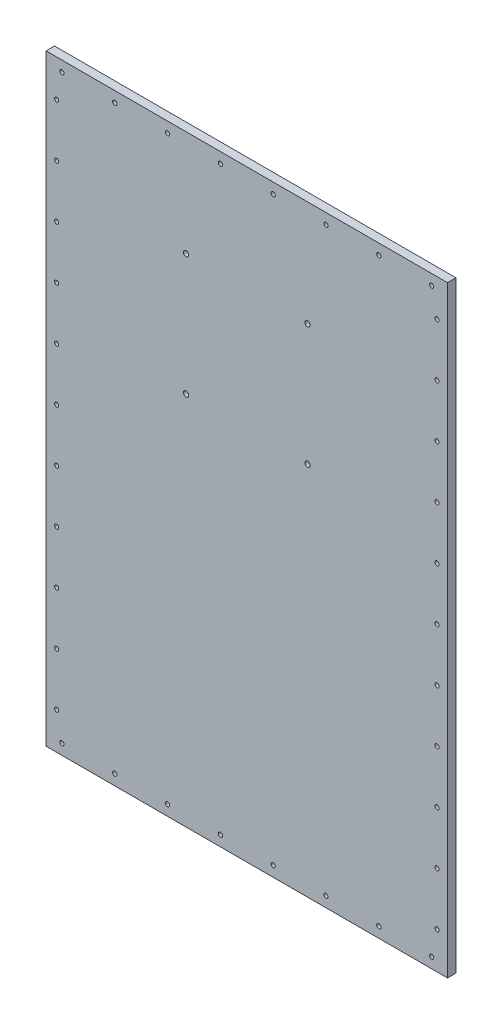
from build123d import *

# Parameters (mm, degrees)
SKETCH_1_W          = 380
SKETCH_1_H          = 570
EXTRUDE_1_DEPTH     = 8
CUT_EXTRUDE_1_REACH = 344.621
SKETCH_2_R          = 2
CUT_EXTRUDE_2_REACH = 344.621
SKETCH_3_R          = 2.5
CUT_EXTRUDE_3_REACH = 344.621
SKETCH_4_R          = 2


with BuildPart() as part:
    # 草图1 → 凸台-拉伸1 (new body)
    with BuildSketch(Plane.XY):
        Rectangle(SKETCH_1_W, SKETCH_1_H)
    extrude(amount=EXTRUDE_1_DEPTH)

    # 草图2 → 切除-拉伸1 (cut, up to next)
    with BuildSketch(Plane.XY.offset(8), mode=Mode.PRIVATE) as cut_extrude_1_sk1:
        with Locations((-180, 250)):
            Circle(SKETCH_2_R)
    cut_extrude_1_tool1 = extrude(cut_extrude_1_sk1.sketch, amount=-CUT_EXTRUDE_1_REACH, mode=Mode.PRIVATE) & part.part
    # 草图2 → 切除-拉伸1 (cut, up to next)
    with BuildSketch(Plane.XY.offset(8), mode=Mode.PRIVATE) as cut_extrude_1_sk2:
        with Locations((-180, 200)):
            Circle(SKETCH_2_R)
    cut_extrude_1_tool2 = extrude(cut_extrude_1_sk2.sketch, amount=-CUT_EXTRUDE_1_REACH, mode=Mode.PRIVATE) & part.part
    # 草图2 → 切除-拉伸1 (cut, up to next)
    with BuildSketch(Plane.XY.offset(8), mode=Mode.PRIVATE) as cut_extrude_1_sk3:
        with Locations((-180, 150)):
            Circle(SKETCH_2_R)
    cut_extrude_1_tool3 = extrude(cut_extrude_1_sk3.sketch, amount=-CUT_EXTRUDE_1_REACH, mode=Mode.PRIVATE) & part.part
    # 草图2 → 切除-拉伸1 (cut, up to next)
    with BuildSketch(Plane.XY.offset(8), mode=Mode.PRIVATE) as cut_extrude_1_sk4:
        with Locations((-180, 100)):
            Circle(SKETCH_2_R)
    cut_extrude_1_tool4 = extrude(cut_extrude_1_sk4.sketch, amount=-CUT_EXTRUDE_1_REACH, mode=Mode.PRIVATE) & part.part
    # 草图2 → 切除-拉伸1 (cut, up to next)
    with BuildSketch(Plane.XY.offset(8), mode=Mode.PRIVATE) as cut_extrude_1_sk5:
        with Locations((-180, 50)):
            Circle(SKETCH_2_R)
    cut_extrude_1_tool5 = extrude(cut_extrude_1_sk5.sketch, amount=-CUT_EXTRUDE_1_REACH, mode=Mode.PRIVATE) & part.part
    # 草图2 → 切除-拉伸1 (cut, up to next)
    with BuildSketch(Plane.XY.offset(8), mode=Mode.PRIVATE) as cut_extrude_1_sk6:
        with Locations((-180, 0)):
            Circle(SKETCH_2_R)
    cut_extrude_1_tool6 = extrude(cut_extrude_1_sk6.sketch, amount=-CUT_EXTRUDE_1_REACH, mode=Mode.PRIVATE) & part.part
    # 草图2 → 切除-拉伸1 (cut, up to next)
    with BuildSketch(Plane.XY.offset(8), mode=Mode.PRIVATE) as cut_extrude_1_sk7:
        with Locations((-180, -50)):
            Circle(SKETCH_2_R)
    cut_extrude_1_tool7 = extrude(cut_extrude_1_sk7.sketch, amount=-CUT_EXTRUDE_1_REACH, mode=Mode.PRIVATE) & part.part
    # 草图2 → 切除-拉伸1 (cut, up to next)
    with BuildSketch(Plane.XY.offset(8), mode=Mode.PRIVATE) as cut_extrude_1_sk8:
        with Locations((-180, -100)):
            Circle(SKETCH_2_R)
    cut_extrude_1_tool8 = extrude(cut_extrude_1_sk8.sketch, amount=-CUT_EXTRUDE_1_REACH, mode=Mode.PRIVATE) & part.part
    # 草图2 → 切除-拉伸1 (cut, up to next)
    with BuildSketch(Plane.XY.offset(8), mode=Mode.PRIVATE) as cut_extrude_1_sk9:
        with Locations((-180, -150)):
            Circle(SKETCH_2_R)
    cut_extrude_1_tool9 = extrude(cut_extrude_1_sk9.sketch, amount=-CUT_EXTRUDE_1_REACH, mode=Mode.PRIVATE) & part.part
    # 草图2 → 切除-拉伸1 (cut, up to next)
    with BuildSketch(Plane.XY.offset(8), mode=Mode.PRIVATE) as cut_extrude_1_sk10:
        with Locations((-180, -200)):
            Circle(SKETCH_2_R)
    cut_extrude_1_tool10 = extrude(cut_extrude_1_sk10.sketch, amount=-CUT_EXTRUDE_1_REACH, mode=Mode.PRIVATE) & part.part
    # 草图2 → 切除-拉伸1 (cut, up to next)
    with BuildSketch(Plane.XY.offset(8), mode=Mode.PRIVATE) as cut_extrude_1_sk11:
        with Locations((-180, -250)):
            Circle(SKETCH_2_R)
    cut_extrude_1_tool11 = extrude(cut_extrude_1_sk11.sketch, amount=-CUT_EXTRUDE_1_REACH, mode=Mode.PRIVATE) & part.part
    # 草图2 → 切除-拉伸1 (cut, up to next)
    with BuildSketch(Plane.XY.offset(8), mode=Mode.PRIVATE) as cut_extrude_1_sk12:
        with Locations((180, -250)):
            Circle(SKETCH_2_R)
    cut_extrude_1_tool12 = extrude(cut_extrude_1_sk12.sketch, amount=-CUT_EXTRUDE_1_REACH, mode=Mode.PRIVATE) & part.part
    # 草图2 → 切除-拉伸1 (cut, up to next)
    with BuildSketch(Plane.XY.offset(8), mode=Mode.PRIVATE) as cut_extrude_1_sk13:
        with Locations((180, -200)):
            Circle(SKETCH_2_R)
    cut_extrude_1_tool13 = extrude(cut_extrude_1_sk13.sketch, amount=-CUT_EXTRUDE_1_REACH, mode=Mode.PRIVATE) & part.part
    # 草图2 → 切除-拉伸1 (cut, up to next)
    with BuildSketch(Plane.XY.offset(8), mode=Mode.PRIVATE) as cut_extrude_1_sk14:
        with Locations((180, -150)):
            Circle(SKETCH_2_R)
    cut_extrude_1_tool14 = extrude(cut_extrude_1_sk14.sketch, amount=-CUT_EXTRUDE_1_REACH, mode=Mode.PRIVATE) & part.part
    # 草图2 → 切除-拉伸1 (cut, up to next)
    with BuildSketch(Plane.XY.offset(8), mode=Mode.PRIVATE) as cut_extrude_1_sk15:
        with Locations((180, -100)):
            Circle(SKETCH_2_R)
    cut_extrude_1_tool15 = extrude(cut_extrude_1_sk15.sketch, amount=-CUT_EXTRUDE_1_REACH, mode=Mode.PRIVATE) & part.part
    # 草图2 → 切除-拉伸1 (cut, up to next)
    with BuildSketch(Plane.XY.offset(8), mode=Mode.PRIVATE) as cut_extrude_1_sk16:
        with Locations((180, -50)):
            Circle(SKETCH_2_R)
    cut_extrude_1_tool16 = extrude(cut_extrude_1_sk16.sketch, amount=-CUT_EXTRUDE_1_REACH, mode=Mode.PRIVATE) & part.part
    # 草图2 → 切除-拉伸1 (cut, up to next)
    with BuildSketch(Plane.XY.offset(8), mode=Mode.PRIVATE) as cut_extrude_1_sk17:
        with Locations((180, 0)):
            Circle(SKETCH_2_R)
    cut_extrude_1_tool17 = extrude(cut_extrude_1_sk17.sketch, amount=-CUT_EXTRUDE_1_REACH, mode=Mode.PRIVATE) & part.part
    # 草图2 → 切除-拉伸1 (cut, up to next)
    with BuildSketch(Plane.XY.offset(8), mode=Mode.PRIVATE) as cut_extrude_1_sk18:
        with Locations((180, 50)):
            Circle(SKETCH_2_R)
    cut_extrude_1_tool18 = extrude(cut_extrude_1_sk18.sketch, amount=-CUT_EXTRUDE_1_REACH, mode=Mode.PRIVATE) & part.part
    # 草图2 → 切除-拉伸1 (cut, up to next)
    with BuildSketch(Plane.XY.offset(8), mode=Mode.PRIVATE) as cut_extrude_1_sk19:
        with Locations((180, 100)):
            Circle(SKETCH_2_R)
    cut_extrude_1_tool19 = extrude(cut_extrude_1_sk19.sketch, amount=-CUT_EXTRUDE_1_REACH, mode=Mode.PRIVATE) & part.part
    # 草图2 → 切除-拉伸1 (cut, up to next)
    with BuildSketch(Plane.XY.offset(8), mode=Mode.PRIVATE) as cut_extrude_1_sk20:
        with Locations((180, 150)):
            Circle(SKETCH_2_R)
    cut_extrude_1_tool20 = extrude(cut_extrude_1_sk20.sketch, amount=-CUT_EXTRUDE_1_REACH, mode=Mode.PRIVATE) & part.part
    # 草图2 → 切除-拉伸1 (cut, up to next)
    with BuildSketch(Plane.XY.offset(8), mode=Mode.PRIVATE) as cut_extrude_1_sk21:
        with Locations((180, 200)):
            Circle(SKETCH_2_R)
    cut_extrude_1_tool21 = extrude(cut_extrude_1_sk21.sketch, amount=-CUT_EXTRUDE_1_REACH, mode=Mode.PRIVATE) & part.part
    # 草图2 → 切除-拉伸1 (cut, up to next)
    with BuildSketch(Plane.XY.offset(8), mode=Mode.PRIVATE) as cut_extrude_1_sk22:
        with Locations((180, 250)):
            Circle(SKETCH_2_R)
    cut_extrude_1_tool22 = extrude(cut_extrude_1_sk22.sketch, amount=-CUT_EXTRUDE_1_REACH, mode=Mode.PRIVATE) & part.part
    add(cut_extrude_1_tool1.solids().sort_by_distance((-180, 250, 8))[0], mode=Mode.SUBTRACT)
    add(cut_extrude_1_tool2.solids().sort_by_distance((-180, 200, 8))[0], mode=Mode.SUBTRACT)
    add(cut_extrude_1_tool3.solids().sort_by_distance((-180, 150, 8))[0], mode=Mode.SUBTRACT)
    add(cut_extrude_1_tool4.solids().sort_by_distance((-180, 100, 8))[0], mode=Mode.SUBTRACT)
    add(cut_extrude_1_tool5.solids().sort_by_distance((-180, 50, 8))[0], mode=Mode.SUBTRACT)
    add(cut_extrude_1_tool6.solids().sort_by_distance((-180, 0, 8))[0], mode=Mode.SUBTRACT)
    add(cut_extrude_1_tool7.solids().sort_by_distance((-180, -50, 8))[0], mode=Mode.SUBTRACT)
    add(cut_extrude_1_tool8.solids().sort_by_distance((-180, -100, 8))[0], mode=Mode.SUBTRACT)
    add(cut_extrude_1_tool9.solids().sort_by_distance((-180, -150, 8))[0], mode=Mode.SUBTRACT)
    add(cut_extrude_1_tool10.solids().sort_by_distance((-180, -200, 8))[0], mode=Mode.SUBTRACT)
    add(cut_extrude_1_tool11.solids().sort_by_distance((-180, -250, 8))[0], mode=Mode.SUBTRACT)
    add(cut_extrude_1_tool12.solids().sort_by_distance((180, -250, 8))[0], mode=Mode.SUBTRACT)
    add(cut_extrude_1_tool13.solids().sort_by_distance((180, -200, 8))[0], mode=Mode.SUBTRACT)
    add(cut_extrude_1_tool14.solids().sort_by_distance((180, -150, 8))[0], mode=Mode.SUBTRACT)
    add(cut_extrude_1_tool15.solids().sort_by_distance((180, -100, 8))[0], mode=Mode.SUBTRACT)
    add(cut_extrude_1_tool16.solids().sort_by_distance((180, -50, 8))[0], mode=Mode.SUBTRACT)
    add(cut_extrude_1_tool17.solids().sort_by_distance((180, 0, 8))[0], mode=Mode.SUBTRACT)
    add(cut_extrude_1_tool18.solids().sort_by_distance((180, 50, 8))[0], mode=Mode.SUBTRACT)
    add(cut_extrude_1_tool19.solids().sort_by_distance((180, 100, 8))[0], mode=Mode.SUBTRACT)
    add(cut_extrude_1_tool20.solids().sort_by_distance((180, 150, 8))[0], mode=Mode.SUBTRACT)
    add(cut_extrude_1_tool21.solids().sort_by_distance((180, 200, 8))[0], mode=Mode.SUBTRACT)
    add(cut_extrude_1_tool22.solids().sort_by_distance((180, 250, 8))[0], mode=Mode.SUBTRACT)

    # 草图3 → 切除-拉伸2 (cut, up to next)
    with BuildSketch(Plane.XY.offset(8), mode=Mode.PRIVATE) as cut_extrude_2_sk1:
        with Locations((-57.5, 185)):
            Circle(SKETCH_3_R)
    cut_extrude_2_tool1 = extrude(cut_extrude_2_sk1.sketch, amount=-CUT_EXTRUDE_2_REACH, mode=Mode.PRIVATE) & part.part
    # 草图3 → 切除-拉伸2 (cut, up to next)
    with BuildSketch(Plane.XY.offset(8), mode=Mode.PRIVATE) as cut_extrude_2_sk2:
        with Locations((57.5, 185)):
            Circle(SKETCH_3_R)
    cut_extrude_2_tool2 = extrude(cut_extrude_2_sk2.sketch, amount=-CUT_EXTRUDE_2_REACH, mode=Mode.PRIVATE) & part.part
    # 草图3 → 切除-拉伸2 (cut, up to next)
    with BuildSketch(Plane.XY.offset(8), mode=Mode.PRIVATE) as cut_extrude_2_sk3:
        with Locations((57.5, 70)):
            Circle(SKETCH_3_R)
    cut_extrude_2_tool3 = extrude(cut_extrude_2_sk3.sketch, amount=-CUT_EXTRUDE_2_REACH, mode=Mode.PRIVATE) & part.part
    # 草图3 → 切除-拉伸2 (cut, up to next)
    with BuildSketch(Plane.XY.offset(8), mode=Mode.PRIVATE) as cut_extrude_2_sk4:
        with Locations((-57.5, 70)):
            Circle(SKETCH_3_R)
    cut_extrude_2_tool4 = extrude(cut_extrude_2_sk4.sketch, amount=-CUT_EXTRUDE_2_REACH, mode=Mode.PRIVATE) & part.part
    add(cut_extrude_2_tool1.solids().sort_by_distance((-57.5, 185, 8))[0], mode=Mode.SUBTRACT)
    add(cut_extrude_2_tool2.solids().sort_by_distance((57.5, 185, 8))[0], mode=Mode.SUBTRACT)
    add(cut_extrude_2_tool3.solids().sort_by_distance((57.5, 70, 8))[0], mode=Mode.SUBTRACT)
    add(cut_extrude_2_tool4.solids().sort_by_distance((-57.5, 70, 8))[0], mode=Mode.SUBTRACT)

    # 草图4 → 切除-拉伸3 (cut, up to next)
    with BuildSketch(Plane.XY.offset(8), mode=Mode.PRIVATE) as cut_extrude_3_sk1:
        with Locations((-175, 275)):
            Circle(SKETCH_4_R)
    cut_extrude_3_tool1 = extrude(cut_extrude_3_sk1.sketch, amount=-CUT_EXTRUDE_3_REACH, mode=Mode.PRIVATE) & part.part
    # 草图4 → 切除-拉伸3 (cut, up to next)
    with BuildSketch(Plane.XY.offset(8), mode=Mode.PRIVATE) as cut_extrude_3_sk2:
        with Locations((-125, 275)):
            Circle(SKETCH_4_R)
    cut_extrude_3_tool2 = extrude(cut_extrude_3_sk2.sketch, amount=-CUT_EXTRUDE_3_REACH, mode=Mode.PRIVATE) & part.part
    # 草图4 → 切除-拉伸3 (cut, up to next)
    with BuildSketch(Plane.XY.offset(8), mode=Mode.PRIVATE) as cut_extrude_3_sk3:
        with Locations((-75, 275)):
            Circle(SKETCH_4_R)
    cut_extrude_3_tool3 = extrude(cut_extrude_3_sk3.sketch, amount=-CUT_EXTRUDE_3_REACH, mode=Mode.PRIVATE) & part.part
    # 草图4 → 切除-拉伸3 (cut, up to next)
    with BuildSketch(Plane.XY.offset(8), mode=Mode.PRIVATE) as cut_extrude_3_sk4:
        with Locations((-25, 275)):
            Circle(SKETCH_4_R)
    cut_extrude_3_tool4 = extrude(cut_extrude_3_sk4.sketch, amount=-CUT_EXTRUDE_3_REACH, mode=Mode.PRIVATE) & part.part
    # 草图4 → 切除-拉伸3 (cut, up to next)
    with BuildSketch(Plane.XY.offset(8), mode=Mode.PRIVATE) as cut_extrude_3_sk5:
        with Locations((25, 275)):
            Circle(SKETCH_4_R)
    cut_extrude_3_tool5 = extrude(cut_extrude_3_sk5.sketch, amount=-CUT_EXTRUDE_3_REACH, mode=Mode.PRIVATE) & part.part
    # 草图4 → 切除-拉伸3 (cut, up to next)
    with BuildSketch(Plane.XY.offset(8), mode=Mode.PRIVATE) as cut_extrude_3_sk6:
        with Locations((75, 275)):
            Circle(SKETCH_4_R)
    cut_extrude_3_tool6 = extrude(cut_extrude_3_sk6.sketch, amount=-CUT_EXTRUDE_3_REACH, mode=Mode.PRIVATE) & part.part
    # 草图4 → 切除-拉伸3 (cut, up to next)
    with BuildSketch(Plane.XY.offset(8), mode=Mode.PRIVATE) as cut_extrude_3_sk7:
        with Locations((125, 275)):
            Circle(SKETCH_4_R)
    cut_extrude_3_tool7 = extrude(cut_extrude_3_sk7.sketch, amount=-CUT_EXTRUDE_3_REACH, mode=Mode.PRIVATE) & part.part
    # 草图4 → 切除-拉伸3 (cut, up to next)
    with BuildSketch(Plane.XY.offset(8), mode=Mode.PRIVATE) as cut_extrude_3_sk8:
        with Locations((175, 275)):
            Circle(SKETCH_4_R)
    cut_extrude_3_tool8 = extrude(cut_extrude_3_sk8.sketch, amount=-CUT_EXTRUDE_3_REACH, mode=Mode.PRIVATE) & part.part
    # 草图4 → 切除-拉伸3 (cut, up to next)
    with BuildSketch(Plane.XY.offset(8), mode=Mode.PRIVATE) as cut_extrude_3_sk9:
        with Locations((175, -275)):
            Circle(SKETCH_4_R)
    cut_extrude_3_tool9 = extrude(cut_extrude_3_sk9.sketch, amount=-CUT_EXTRUDE_3_REACH, mode=Mode.PRIVATE) & part.part
    # 草图4 → 切除-拉伸3 (cut, up to next)
    with BuildSketch(Plane.XY.offset(8), mode=Mode.PRIVATE) as cut_extrude_3_sk10:
        with Locations((125, -275)):
            Circle(SKETCH_4_R)
    cut_extrude_3_tool10 = extrude(cut_extrude_3_sk10.sketch, amount=-CUT_EXTRUDE_3_REACH, mode=Mode.PRIVATE) & part.part
    # 草图4 → 切除-拉伸3 (cut, up to next)
    with BuildSketch(Plane.XY.offset(8), mode=Mode.PRIVATE) as cut_extrude_3_sk11:
        with Locations((75, -275)):
            Circle(SKETCH_4_R)
    cut_extrude_3_tool11 = extrude(cut_extrude_3_sk11.sketch, amount=-CUT_EXTRUDE_3_REACH, mode=Mode.PRIVATE) & part.part
    # 草图4 → 切除-拉伸3 (cut, up to next)
    with BuildSketch(Plane.XY.offset(8), mode=Mode.PRIVATE) as cut_extrude_3_sk12:
        with Locations((25, -275)):
            Circle(SKETCH_4_R)
    cut_extrude_3_tool12 = extrude(cut_extrude_3_sk12.sketch, amount=-CUT_EXTRUDE_3_REACH, mode=Mode.PRIVATE) & part.part
    # 草图4 → 切除-拉伸3 (cut, up to next)
    with BuildSketch(Plane.XY.offset(8), mode=Mode.PRIVATE) as cut_extrude_3_sk13:
        with Locations((-25, -275)):
            Circle(SKETCH_4_R)
    cut_extrude_3_tool13 = extrude(cut_extrude_3_sk13.sketch, amount=-CUT_EXTRUDE_3_REACH, mode=Mode.PRIVATE) & part.part
    # 草图4 → 切除-拉伸3 (cut, up to next)
    with BuildSketch(Plane.XY.offset(8), mode=Mode.PRIVATE) as cut_extrude_3_sk14:
        with Locations((-75, -275)):
            Circle(SKETCH_4_R)
    cut_extrude_3_tool14 = extrude(cut_extrude_3_sk14.sketch, amount=-CUT_EXTRUDE_3_REACH, mode=Mode.PRIVATE) & part.part
    # 草图4 → 切除-拉伸3 (cut, up to next)
    with BuildSketch(Plane.XY.offset(8), mode=Mode.PRIVATE) as cut_extrude_3_sk15:
        with Locations((-125, -275)):
            Circle(SKETCH_4_R)
    cut_extrude_3_tool15 = extrude(cut_extrude_3_sk15.sketch, amount=-CUT_EXTRUDE_3_REACH, mode=Mode.PRIVATE) & part.part
    # 草图4 → 切除-拉伸3 (cut, up to next)
    with BuildSketch(Plane.XY.offset(8), mode=Mode.PRIVATE) as cut_extrude_3_sk16:
        with Locations((-175, -275)):
            Circle(SKETCH_4_R)
    cut_extrude_3_tool16 = extrude(cut_extrude_3_sk16.sketch, amount=-CUT_EXTRUDE_3_REACH, mode=Mode.PRIVATE) & part.part
    add(cut_extrude_3_tool1.solids().sort_by_distance((-175, 275, 8))[0], mode=Mode.SUBTRACT)
    add(cut_extrude_3_tool2.solids().sort_by_distance((-125, 275, 8))[0], mode=Mode.SUBTRACT)
    add(cut_extrude_3_tool3.solids().sort_by_distance((-75, 275, 8))[0], mode=Mode.SUBTRACT)
    add(cut_extrude_3_tool4.solids().sort_by_distance((-25, 275, 8))[0], mode=Mode.SUBTRACT)
    add(cut_extrude_3_tool5.solids().sort_by_distance((25, 275, 8))[0], mode=Mode.SUBTRACT)
    add(cut_extrude_3_tool6.solids().sort_by_distance((75, 275, 8))[0], mode=Mode.SUBTRACT)
    add(cut_extrude_3_tool7.solids().sort_by_distance((125, 275, 8))[0], mode=Mode.SUBTRACT)
    add(cut_extrude_3_tool8.solids().sort_by_distance((175, 275, 8))[0], mode=Mode.SUBTRACT)
    add(cut_extrude_3_tool9.solids().sort_by_distance((175, -275, 8))[0], mode=Mode.SUBTRACT)
    add(cut_extrude_3_tool10.solids().sort_by_distance((125, -275, 8))[0], mode=Mode.SUBTRACT)
    add(cut_extrude_3_tool11.solids().sort_by_distance((75, -275, 8))[0], mode=Mode.SUBTRACT)
    add(cut_extrude_3_tool12.solids().sort_by_distance((25, -275, 8))[0], mode=Mode.SUBTRACT)
    add(cut_extrude_3_tool13.solids().sort_by_distance((-25, -275, 8))[0], mode=Mode.SUBTRACT)
    add(cut_extrude_3_tool14.solids().sort_by_distance((-75, -275, 8))[0], mode=Mode.SUBTRACT)
    add(cut_extrude_3_tool15.solids().sort_by_distance((-125, -275, 8))[0], mode=Mode.SUBTRACT)
    add(cut_extrude_3_tool16.solids().sort_by_distance((-175, -275, 8))[0], mode=Mode.SUBTRACT)


solid = part.part
